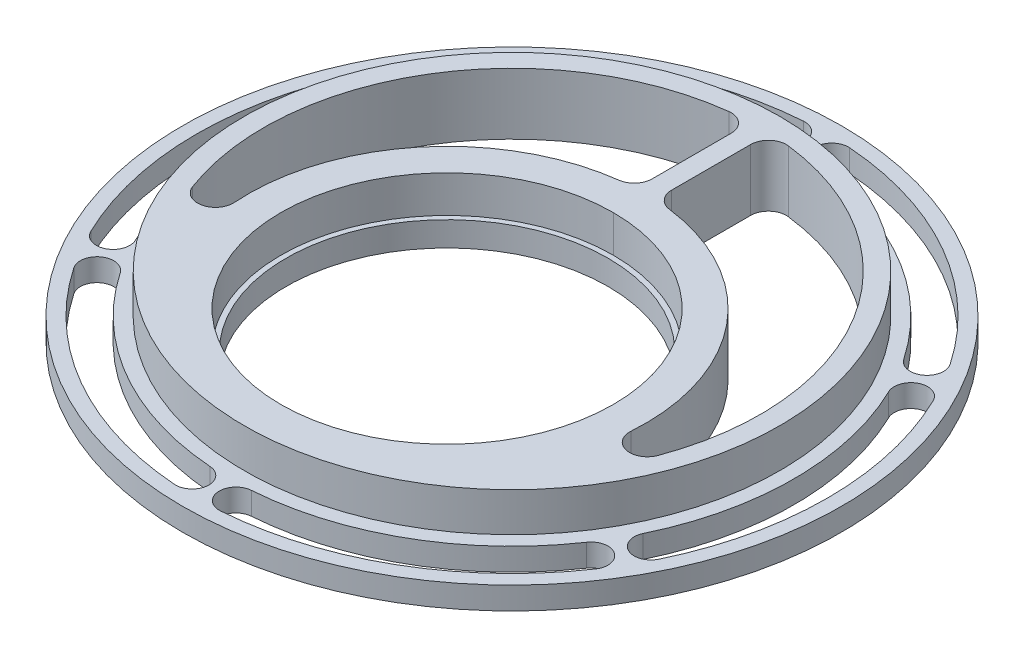
from build123d import *

# Parameters (mm, degrees)
SLOTTED_BODY_EXTRUDE_DEPTH      = 4.191
SLOTTED_BODY_EXTRUDE_DEPTH_BACK = 0.2032
SKETCH1_R                       = 64.4525
SKETCH1_R_2                     = 30.988
SKETCH5_R                       = 52.3875
BOSS_EXTRUDE3_DEPTH             = 7.62
SKETCH6_R                       = 32.512
CUT_EXTRUDE5_DEPTH              = 92.937971014
SKETCH8_R                       = 32.512
SKETCH8_R_2                     = 31.496
BOSS_EXTRUDE4_DEPTH             = 4.795000062
CUT_EXTRUDE6_DEPTH              = 92.937971014
CUT_EXTRUDE7_DEPTH              = 92.467556612


with BuildPart() as part:
    # Sketch1 → Slotted-Body Extrude (new, two sides: drawn at the far end of the back side and taken through both)
    with BuildSketch(Plane(origin=(0, 0, 0), x_dir=(1, 0, 0), z_dir=(0, 1, 0)).offset(-SLOTTED_BODY_EXTRUDE_DEPTH_BACK)):
        Circle(SKETCH1_R)
        with Locations((0, -12.7)):
            Circle(SKETCH1_R_2, mode=Mode.SUBTRACT)
    extrude(amount=SLOTTED_BODY_EXTRUDE_DEPTH + SLOTTED_BODY_EXTRUDE_DEPTH_BACK)

    # Sketch5 → Boss-Extrude3 (add)
    with BuildSketch(Plane(origin=(0, 4.191, 0), x_dir=(1, 0, 0), z_dir=(0, 1, 0))):
        Circle(SKETCH5_R)
    extrude(amount=BOSS_EXTRUDE3_DEPTH)

    # Sketch6 → Cut-Extrude5 (cut, through all)
    with BuildSketch(Plane.XZ.offset(0.2032)):
        with Locations((0, 12.7)):
            Circle(SKETCH6_R)
    extrude(amount=-CUT_EXTRUDE5_DEPTH, mode=Mode.SUBTRACT)

    # Sketch16 → Cut-Extrude6 (cut, through all)
    with BuildSketch(Plane(origin=(0, 11.811, 0), x_dir=(1, 0, 0), z_dir=(0, 1, 0))):
        with BuildLine():
            ThreePointArc((5.815616197, 48.228125762), (3.080466829, 47.37396317), (1.905, 44.760744171))
            Line((1.905, 44.760744171), (1.905, 29.30917357))
            ThreePointArc((1.905, 29.30917357), (2.775290296, 27.00232019), (4.952428786, 25.845148763))
            ThreePointArc((4.952428786, 25.845148763), (30.083852846, 11.901155297), (38.761124089, -15.498267924))
            ThreePointArc((38.761124089, -15.498267924), (41.501270881, -19.162235056), (45.517024238, -16.969797016))
            ThreePointArc((45.517024238, -16.969797016), (41.490387768, 25.265019871), (5.815616197, 48.228125762))
        make_face()
        with BuildLine():
            Line((-1.905, 29.30917357), (-1.905, 44.760744171))
            ThreePointArc((-1.905, 44.760744171), (-3.080466829, 47.37396317), (-5.815616197, 48.228125762))
            ThreePointArc((-5.815616197, 48.228125762), (-41.490387768, 25.265019871), (-45.517024238, -16.969797016))
            ThreePointArc((-45.517024238, -16.969797016), (-41.501270881, -19.162235056), (-38.761124089, -15.498267924))
            ThreePointArc((-38.761124089, -15.498267924), (-30.083852846, 11.901155297), (-4.952428786, 25.845148763))
            ThreePointArc((-4.952428786, 25.845148763), (-2.775290296, 27.00232019), (-1.905, 29.30917357))
        make_face()
    extrude(amount=-CUT_EXTRUDE6_DEPTH, mode=Mode.SUBTRACT)

    # Sketch12 → Cut-Extrude7 (cut, through all)
    with BuildSketch(Plane(origin=(0, 4.191, 0), x_dir=(1, 0, 0), z_dir=(0, 1, 0))):
        with BuildLine():
            ThreePointArc((-51.016643626, -34.67283652), (-30.84195, -53.419824404), (-4.519235435, -61.518127656))
            ThreePointArc((-4.519235435, -61.518127656), (-1.024979245, -58.502126976), (-4.040979925, -55.007870786))
            ThreePointArc((-4.040979925, -55.007870786), (-27.57805, -47.766583774), (-45.617723547, -31.003526664))
            ThreePointArc((-45.617723547, -31.003526664), (-50.151838514, -30.138721553), (-51.016643626, -34.67283652))
        make_face()
        with BuildLine():
            ThreePointArc((-55.535879061, -26.845291136), (-51.176817759, -28.363405424), (-49.658703471, -24.004344122))
            ThreePointArc((-49.658703471, -24.004344122), (-55.1561, 0), (-49.658703471, 24.004344122))
            ThreePointArc((-49.658703471, 24.004344122), (-51.176817759, 28.363405424), (-55.535879061, 26.845291136))
            ThreePointArc((-55.535879061, 26.845291136), (-61.6839, 0), (-55.535879061, -26.845291136))
        make_face()
        with BuildLine():
            ThreePointArc((-51.016643626, 34.67283652), (-50.151838514, 30.138721553), (-45.617723547, 31.003526664))
            ThreePointArc((-45.617723547, 31.003526664), (-27.57805, 47.766583774), (-4.040979925, 55.007870786))
            ThreePointArc((-4.040979925, 55.007870786), (-1.024979245, 58.502126976), (-4.519235435, 61.518127656))
            ThreePointArc((-4.519235435, 61.518127656), (-30.84195, 53.419824404), (-51.016643626, 34.67283652))
        make_face()
        with BuildLine():
            ThreePointArc((4.519235435, 61.518127656), (1.024979245, 58.502126976), (4.040979925, 55.007870786))
            ThreePointArc((4.040979925, 55.007870786), (27.57805, 47.766583774), (45.617723547, 31.003526664))
            ThreePointArc((45.617723547, 31.003526664), (50.151838514, 30.138721553), (51.016643626, 34.67283652))
            ThreePointArc((51.016643626, 34.67283652), (30.84195, 53.419824404), (4.519235435, 61.518127656))
        make_face()
        with BuildLine():
            ThreePointArc((55.535879061, 26.845291136), (51.176817759, 28.363405424), (49.658703471, 24.004344122))
            ThreePointArc((49.658703471, 24.004344122), (55.1561, 0), (49.658703471, -24.004344122))
            ThreePointArc((49.658703471, -24.004344122), (51.176817759, -28.363405424), (55.535879061, -26.845291136))
            ThreePointArc((55.535879061, -26.845291136), (61.6839, 0), (55.535879061, 26.845291136))
        make_face()
        with BuildLine():
            ThreePointArc((51.016643626, -34.67283652), (50.151838514, -30.138721553), (45.617723547, -31.003526664))
            ThreePointArc((45.617723547, -31.003526664), (27.57805, -47.766583774), (4.040979925, -55.007870786))
            ThreePointArc((4.040979925, -55.007870786), (1.024979245, -58.502126976), (4.519235435, -61.518127656))
            ThreePointArc((4.519235435, -61.518127656), (30.84195, -53.419824404), (51.016643626, -34.67283652))
        make_face()
    extrude(amount=-CUT_EXTRUDE7_DEPTH, mode=Mode.SUBTRACT)


with BuildPart() as body_2:
    # Sketch8 → Boss-Extrude4 (new body)
    with BuildSketch(Plane.XZ.offset(0.2032)):
        with Locations((0, 12.7)):
            Circle(SKETCH8_R)
        with Locations((0, 12.7)):
            Circle(SKETCH8_R_2, mode=Mode.SUBTRACT)
    extrude(amount=-BOSS_EXTRUDE4_DEPTH)


solid = Compound([part.part, body_2.part])
